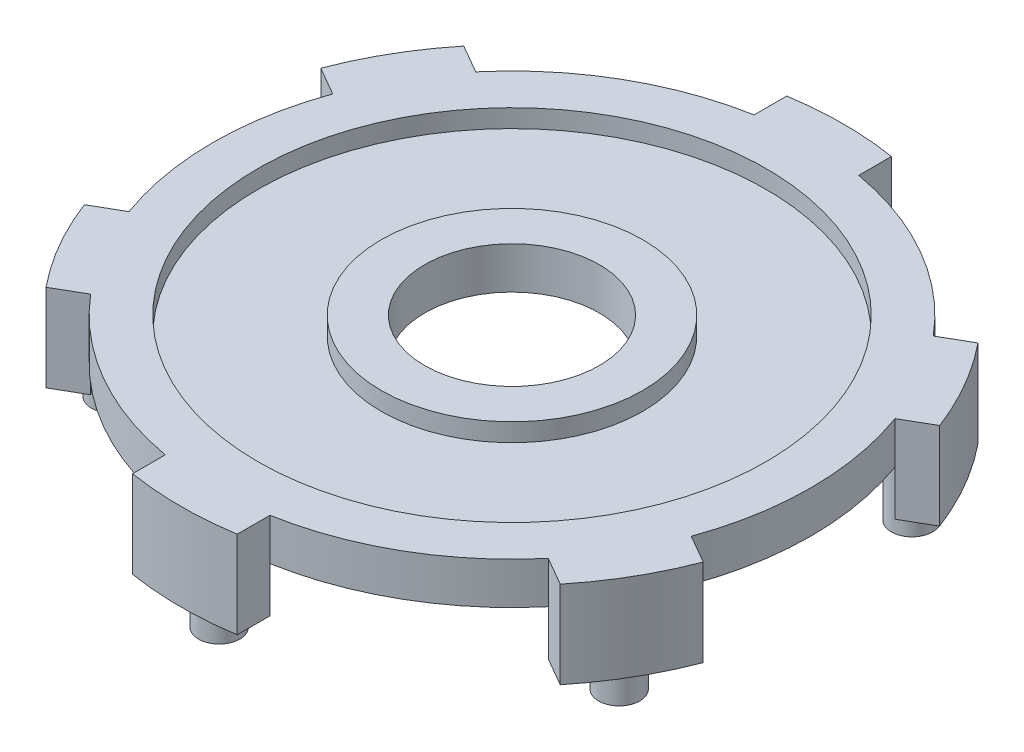
from build123d import *

# Parameters (mm, degrees)
SKETCH1_R           = 13.4239
BOSS_EXTRUDE1_DEPTH = 1.8796
BOSS_EXTRUDE2_DEPTH = 1.8796
SKETCH3_R           = 11.4046
CUT_EXTRUDE1_DEPTH  = 0.8128
SKETCH4_R           = 5.8674
BOSS_EXTRUDE3_DEPTH = 0.8128
SKETCH5_R           = 3.9243
CUT_EXTRUDE2_DEPTH  = 21.437605201
SKETCH6_R           = 7.7216
BOSS_EXTRUDE4_DEPTH = 1.778
SKETCH7_R           = 6.5532
CUT_EXTRUDE3_DEPTH  = 1.778
BOSS_EXTRUDE5_DEPTH = 2.032
SKETCH9_R           = 0.9271
BOSS_EXTRUDE6_DEPTH = 3.683
CIRPATTERN1_COUNT   = 6


with BuildPart() as part:
    # Sketch1 → Boss-Extrude1 (new body)
    with BuildSketch(Plane(origin=(0, 0, 0), x_dir=(1, 0, 0), z_dir=(0, 1, 0))):
        with Locations(Location((0, 0, 0), (0, 0, 270))):
            Circle(SKETCH1_R)
    extrude(amount=BOSS_EXTRUDE1_DEPTH)

    # Sketch2 → Boss-Extrude2 (add)
    with BuildSketch(Plane(origin=(0, 1.8796, 0), x_dir=(1, 0, 0), z_dir=(0, 1, 0))):
        with BuildLine():
            Line((-13.892276606, 5.307740723), (-4.699, 0))
            Line((-4.699, 0), (-13.892276606, -5.307740723))
            ThreePointArc((-13.892276606, -5.307740723), (-12.879269997, -7.43585), (-11.542776606, -9.377194096))
            Line((-11.542776606, -9.377194096), (-2.3495, -4.069453372))
            Line((-2.3495, -4.069453372), (-2.3495, -14.684934819))
            ThreePointArc((-2.3495, -14.684934819), (0, -14.8717), (2.3495, -14.684934819))
            Line((2.3495, -14.684934819), (2.3495, -4.069453372))
            Line((2.3495, -4.069453372), (11.542776606, -9.377194096))
            ThreePointArc((11.542776606, -9.377194096), (12.879269997, -7.43585), (13.892276606, -5.307740723))
            Line((13.892276606, -5.307740723), (4.699, 0))
            Line((4.699, 0), (13.892276606, 5.307740723))
            ThreePointArc((13.892276606, 5.307740723), (12.879269997, 7.43585), (11.542776606, 9.377194096))
            Line((11.542776606, 9.377194096), (2.3495, 4.069453372))
            Line((2.3495, 4.069453372), (2.3495, 14.684934819))
            ThreePointArc((2.3495, 14.684934819), (0, 14.8717), (-2.3495, 14.684934819))
            Line((-2.3495, 14.684934819), (-2.3495, 4.069453372))
            Line((-2.3495, 4.069453372), (-11.542776606, 9.377194096))
            ThreePointArc((-11.542776606, 9.377194096), (-12.879269997, 7.43585), (-13.892276606, 5.307740723))
        make_face()
    extrude(amount=-BOSS_EXTRUDE2_DEPTH)

    # Sketch3 → Cut-Extrude1 (cut)
    with BuildSketch(Plane(origin=(0, 1.8796, 0), x_dir=(1, 0, 0), z_dir=(0, 1, 0))):
        with Locations(Location((0, 0, 0), (0, 0, 270))):
            Circle(SKETCH3_R)
    extrude(amount=-CUT_EXTRUDE1_DEPTH, mode=Mode.SUBTRACT)

    # Sketch4 → Boss-Extrude3 (add)
    with BuildSketch(Plane(origin=(0, 1.0668, 0), x_dir=(1, 0, 0), z_dir=(0, 1, 0))):
        with Locations(Location((0, 0, 0), (0, 0, 270))):
            Circle(SKETCH4_R)
    extrude(amount=BOSS_EXTRUDE3_DEPTH)

    # Sketch5 → Cut-Extrude2 (cut, through all)
    with BuildSketch(Plane(origin=(0, 1.8796, 0), x_dir=(1, 0, 0), z_dir=(0, 1, 0))):
        with Locations(Location((0, 0, 0), (0, 0, 270))):
            Circle(SKETCH5_R)
    extrude(amount=-CUT_EXTRUDE2_DEPTH, mode=Mode.SUBTRACT)

    # Sketch6 → Boss-Extrude4 (add)
    with BuildSketch(Plane.XZ):
        with Locations(Location((0, 0, 0), (0, 0, 90))):
            Circle(SKETCH6_R)
    extrude(amount=BOSS_EXTRUDE4_DEPTH)

    # Sketch7 → Cut-Extrude3 (cut)
    with BuildSketch(Plane.XZ.offset(1.778)):
        with Locations(Location((0, 0, 0), (0, 0, 270))):
            Circle(SKETCH7_R)
    extrude(amount=-CUT_EXTRUDE3_DEPTH, mode=Mode.SUBTRACT)

    # Sketch8 → Boss-Extrude5 (add)
    with BuildSketch(Plane.XZ):
        with BuildLine():
            Line((-2.3495, -13.216691756), (-2.3495, -14.684934819))
            ThreePointArc((-2.3495, -14.684934819), (0, -14.8717), (2.3495, -14.684934819))
            Line((2.3495, -14.684934819), (2.3495, -13.216691756))
            ThreePointArc((2.3495, -13.216691756), (0, -13.4239), (-2.3495, -13.216691756))
        make_face()
        with BuildLine():
            Line((10.271240814, -8.643072564), (11.542776606, -9.377194096))
            ThreePointArc((11.542776606, -9.377194096), (12.879269997, -7.43585), (13.892276606, -5.307740723))
            Line((13.892276606, -5.307740723), (12.620740814, -4.573619192))
            ThreePointArc((12.620740814, -4.573619192), (11.625438418, -6.71195), (10.271240814, -8.643072564))
        make_face()
        with BuildLine():
            Line((12.620740814, 4.573619192), (13.892276606, 5.307740723))
            ThreePointArc((13.892276606, 5.307740723), (12.879269997, 7.43585), (11.542776606, 9.377194096))
            Line((11.542776606, 9.377194096), (10.271240814, 8.643072564))
            ThreePointArc((10.271240814, 8.643072564), (11.625438418, 6.71195), (12.620740814, 4.573619192))
        make_face()
        with BuildLine():
            Line((2.3495, 13.216691756), (2.3495, 14.684934819))
            ThreePointArc((2.3495, 14.684934819), (0, 14.8717), (-2.3495, 14.684934819))
            Line((-2.3495, 14.684934819), (-2.3495, 13.216691756))
            ThreePointArc((-2.3495, 13.216691756), (0, 13.4239), (2.3495, 13.216691756))
        make_face()
        with BuildLine():
            Line((-10.271240814, 8.643072564), (-11.542776606, 9.377194096))
            ThreePointArc((-11.542776606, 9.377194096), (-12.879269997, 7.43585), (-13.892276606, 5.307740723))
            Line((-13.892276606, 5.307740723), (-12.620740814, 4.573619192))
            ThreePointArc((-12.620740814, 4.573619192), (-11.625438418, 6.71195), (-10.271240814, 8.643072564))
        make_face()
        with BuildLine():
            Line((-12.620740814, -4.573619192), (-13.892276606, -5.307740723))
            ThreePointArc((-13.892276606, -5.307740723), (-12.879269997, -7.43585), (-11.542776606, -9.377194096))
            Line((-11.542776606, -9.377194096), (-10.271240814, -8.643072564))
            ThreePointArc((-10.271240814, -8.643072564), (-11.625438418, -6.71195), (-12.620740814, -4.573619192))
        make_face()
    extrude(amount=BOSS_EXTRUDE5_DEPTH)

    # Sketch9 → Boss-Extrude6 (add)
    with BuildSketch(Plane.XZ):
        with Locations(Location((0, 13.1445, 0), (0, 0, 15.623041056))):
            Circle(SKETCH9_R)
    boss_extrude6 = extrude(amount=BOSS_EXTRUDE6_DEPTH)

    # CirPattern1: Boss-Extrude6 ×6 about axis
    cirpattern1_axis = Axis((0, 0, 0), (0, 1, 0))
    for i in range(1, CIRPATTERN1_COUNT):
        add(boss_extrude6.rotate(cirpattern1_axis, i * 360 / CIRPATTERN1_COUNT))


solid = part.part
